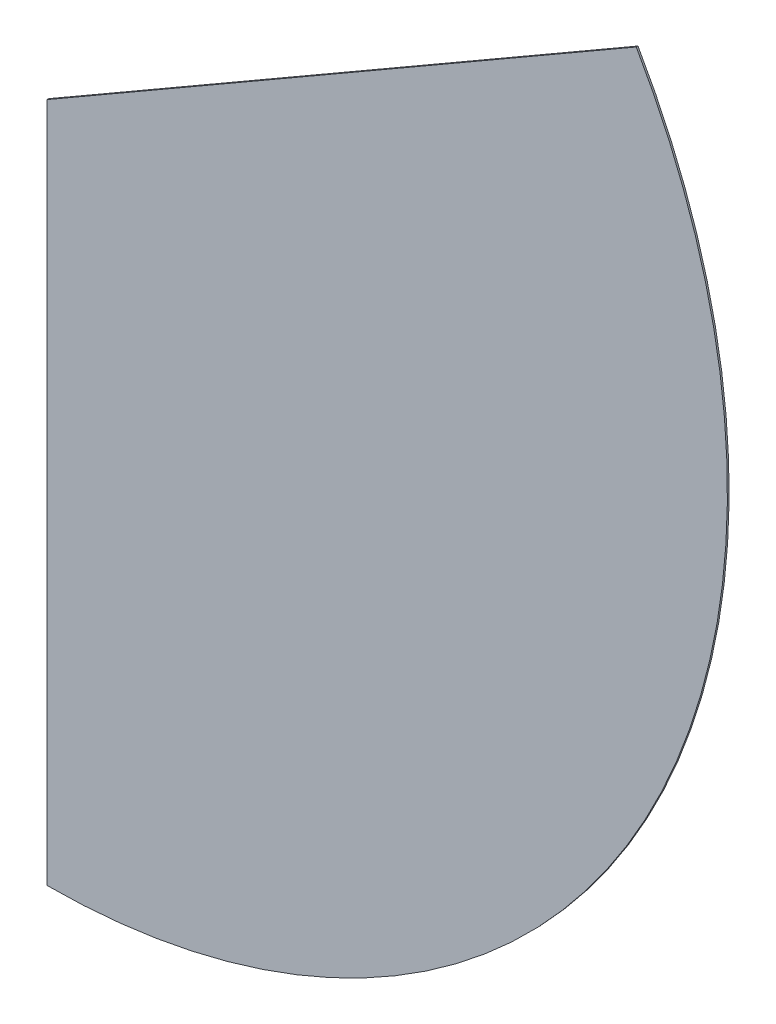
from build123d import *

# Parameters (mm, degrees)
BOARD_DEPTH = 0.39116


with BuildPart() as part:
    # 草圖1 → Board (new body)
    with BuildSketch(Plane.XY):
        with BuildLine():
            Line((0, 0), (134.233937587, 77.5))
            ThreePointArc((134.233937587, 77.5), (134.233937587, -77.5), (0, -155))
            Line((0, -155), (0, 0))
        make_face()
    extrude(amount=BOARD_DEPTH)


solid = part.part
